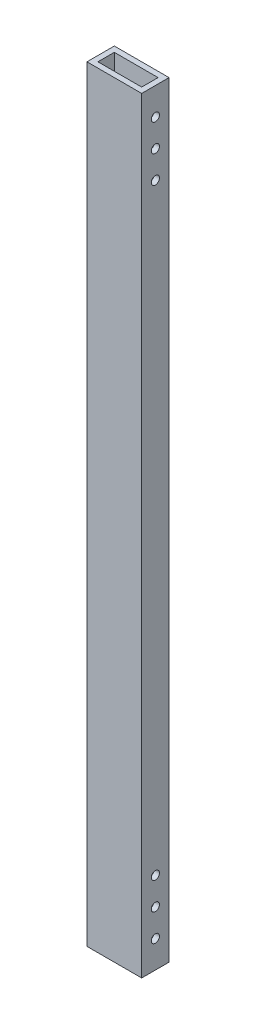
from build123d import *

# Parameters (mm, degrees)
SKETCH_1_W          = 20
SKETCH_1_H          = 10
SKETCH_1_W_2        = 16
SKETCH_1_H_2        = 6
EXTRUDE_1_DEPTH     = 140
SKETCH_3_R          = 1.5
CUT_EXTRUDE_1_DEPTH = 142.509716981


with BuildPart() as part:
    # 草图1 → 凸台-拉伸1 (new, symmetric)
    with BuildSketch(Plane(origin=(0, 0, 0), x_dir=(1, 0, 0), z_dir=(0, 1, 0))):
        Rectangle(SKETCH_1_W, SKETCH_1_H)
        Rectangle(SKETCH_1_W_2, SKETCH_1_H_2, mode=Mode.SUBTRACT)
    extrude(amount=EXTRUDE_1_DEPTH, both=True)

    # 草图3 → 切除-拉伸1 (cut, through all)
    with BuildSketch(Plane(origin=(10, 0, 0), x_dir=(0, 0, -1), z_dir=(1, 0, 0))):
        with Locations((0, 130)):
            Circle(SKETCH_3_R)
        with Locations((0, 120)):
            Circle(SKETCH_3_R)
        with Locations((0, 110)):
            Circle(SKETCH_3_R)
        with Locations((0, -110)):
            Circle(SKETCH_3_R)
        with Locations((0, -120)):
            Circle(SKETCH_3_R)
        with Locations((0, -130)):
            Circle(SKETCH_3_R)
    extrude(amount=-CUT_EXTRUDE_1_DEPTH, mode=Mode.SUBTRACT)


solid = part.part
